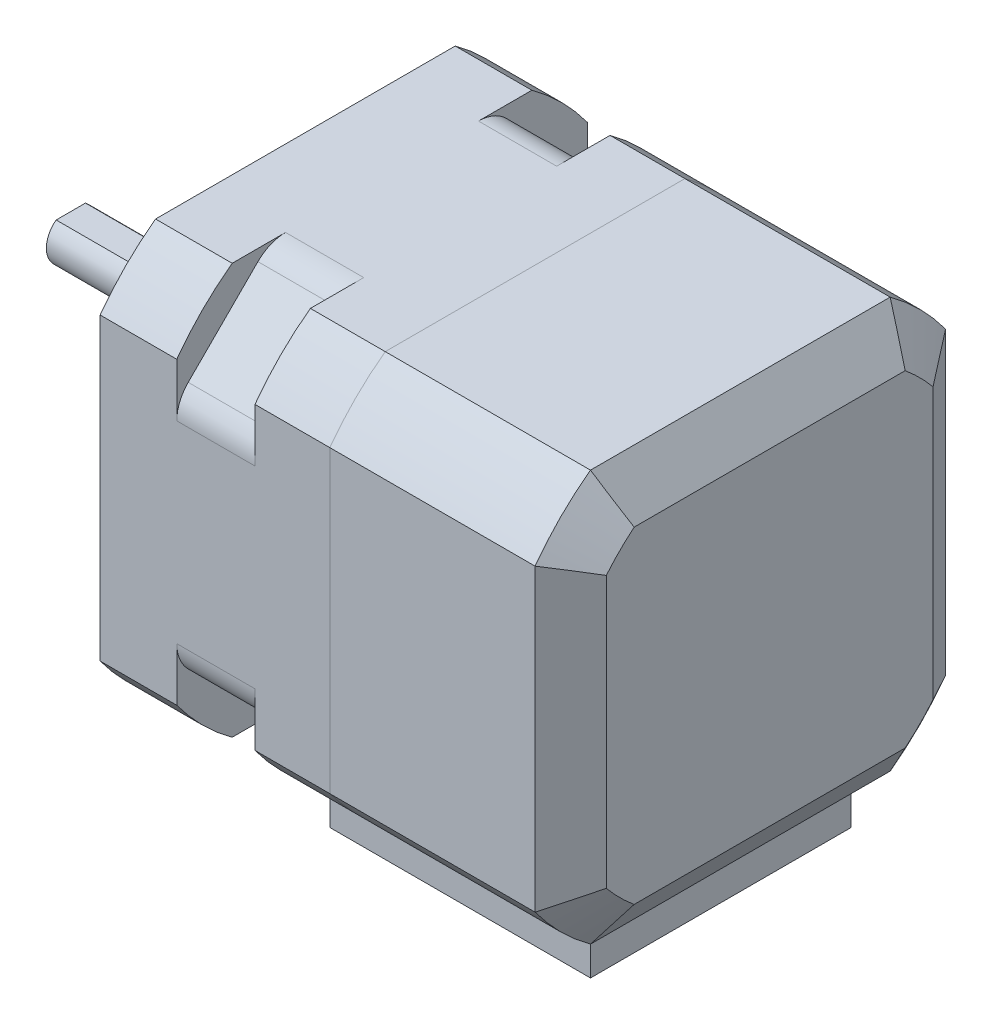
from build123d import *
from OCP.BRepFilletAPI import BRepFilletAPI_MakeChamfer

# Parameters (mm, degrees)
ESQUISSE1_W                  = 42
ESQUISSE1_H                  = 42
BOSS_EXTRU_1_DEPTH           = 47.5
ESQUISSE2_R                  = 11
BOSS_EXTRU_2_DEPTH           = 2
ESQUISSE3_R                  = 2.5
BOSS_EXTRU_3_DEPTH           = 24
TROU_TARAUD_M31_D            = 2.5
TROU_TARAUD_M31_DEPTH        = 4
TROU_TARAUD_M31_TIP          = 0.751075774
ESQUISSE6_OUTSIDE_W          = 62.59
ESQUISSE6_OUTSIDE_H          = 62.59
ESQUISSE6_OUTSIDE_R          = 26
ENL_V_MAT_EXTRU_1_DEPTH      = 57.020085684
ENL_V_MAT_EXTRU_2_DEPTH      = 57.020085684
ENL_V_MAT_EXTRU_2_DEPTH_BACK = 57.020085684
CHANFREIN1_SIZE              = 3
CHANFREIN1_SIZE2             = 4.28444402
ESQUISSE10_W                 = 26.659419434
ESQUISSE10_H                 = 26.659419434
BOSS_EXTRU_5_DEPTH           = 10
CHANFREIN2_SIZE              = 5
ESQUISSE11_OUTSIDE_W         = 63.576
ESQUISSE11_OUTSIDE_H         = 73.576
ENL_V_MAT_EXTRU_3_DEPTH      = 8
CONG_1_R                     = 4


with BuildPart() as part:
    # Esquisse1 → Boss.-Extru.1 (new body)
    with BuildSketch(Plane(origin=(0, 0, 0), x_dir=(0, 0, -1), z_dir=(1, 0, 0))):
        Rectangle(ESQUISSE1_W, ESQUISSE1_H)
    extrude(amount=BOSS_EXTRU_1_DEPTH)

    # Esquisse2 → Boss.-Extru.2 (add)
    with BuildSketch(Plane(origin=(0, 0, 0), x_dir=(0, 0, -1), z_dir=(1, 0, 0))):
        Circle(ESQUISSE2_R)
    extrude(amount=-BOSS_EXTRU_2_DEPTH)

    # Esquisse3 → Boss.-Extru.3 (add)
    with BuildSketch(Plane.ZY):
        with Locations(Location((0, 0, 0), (0, 0, 180))):
            Circle(ESQUISSE3_R)
    extrude(amount=BOSS_EXTRU_3_DEPTH)

    # Trou taraudé M31
    with Locations(Plane.ZY):
        with Locations((-15.5, 15.5), (15.5, 15.5), (-15.5, -15.5), (15.5, -15.5)):
            Hole(TROU_TARAUD_M31_D / 2, depth=TROU_TARAUD_M31_DEPTH)
            with Locations((0, 0, -(TROU_TARAUD_M31_DEPTH + TROU_TARAUD_M31_TIP / 2))):  # 118° drill point
                Cone(0, TROU_TARAUD_M31_D / 2, TROU_TARAUD_M31_TIP, mode=Mode.SUBTRACT)

    # Esquisse6 outside → Enlèv. mat.-Extru.1 (cut, through all)
    with BuildSketch(Plane(origin=(0, 0, 0), x_dir=(0, 0, -1), z_dir=(1, 0, 0))):
        Rectangle(ESQUISSE6_OUTSIDE_W, ESQUISSE6_OUTSIDE_H)
        Circle(ESQUISSE6_OUTSIDE_R, mode=Mode.SUBTRACT)
    extrude(amount=ENL_V_MAT_EXTRU_1_DEPTH, mode=Mode.SUBTRACT)

    # Esquisse7 → Enlèv. mat.-Extru.2 (cut, two sides: drawn at the far end of the back side and taken through both)
    with BuildSketch(Plane.XY.offset(-ENL_V_MAT_EXTRU_2_DEPTH_BACK)):
        Polygon((-184.216510411, 2), (-24, 2), (-9, 2), (-9, 2.5), (-9, 162.716510411), (-225.598714738, 398.856972015), (-400.815225149, 238.140461604), align=None)
    extrude(amount=ENL_V_MAT_EXTRU_2_DEPTH + ENL_V_MAT_EXTRU_2_DEPTH_BACK, mode=Mode.SUBTRACT)

    # Chanfrein1: one chamfer whose edges measure the first distance from different faces: ONE call of the kernel's chamfer builder (chamfer() names one face for all edges)
    chanfrein1_edges_1 = [part.edges().sort_by_distance(p)[0] for p in [
        (47.5, 0, 21),
    ]]
    chanfrein1_side_1 = [part.faces().sort_by_distance(p)[0] for p in [
        (23.75, 0, 21),
    ]]
    chanfrein1_edges_2 = [part.edges().sort_by_distance(p)[0] for p in [
        (47.5, -21, 0),
    ]]
    chanfrein1_side_2 = [part.faces().sort_by_distance(p)[0] for p in [
        (23.75, -21, 0),
    ]]
    chanfrein1_edges_3 = [part.edges().sort_by_distance(p)[0] for p in [
        (47.5, 0, -21),
    ]]
    chanfrein1_side_3 = [part.faces().sort_by_distance(p)[0] for p in [
        (23.75, 0, -21),
    ]]
    chanfrein1_edges_4 = [part.edges().sort_by_distance(p)[0] for p in [
        (47.5, 21, 0),
    ]]
    chanfrein1_side_4 = [part.faces().sort_by_distance(p)[0] for p in [
        (23.75, 21, 0),
    ]]
    chanfrein1_edges_5 = [part.edges().sort_by_distance(p)[0] for p in [
        (47.5, -18.384776311, 18.384776311),
    ]]
    chanfrein1_side_5 = [part.faces().sort_by_distance(p)[0] for p in [
        (23.75, -18.384776311, 18.384776311),
    ]]
    chanfrein1_edges_6 = [part.edges().sort_by_distance(p)[0] for p in [
        (47.5, 18.384776311, 18.384776311),
    ]]
    chanfrein1_side_6 = [part.faces().sort_by_distance(p)[0] for p in [
        (23.75, 18.384776311, 18.384776311),
    ]]
    chanfrein1_edges_7 = [part.edges().sort_by_distance(p)[0] for p in [
        (47.5, -18.384776311, -18.384776311),
    ]]
    chanfrein1_side_7 = [part.faces().sort_by_distance(p)[0] for p in [
        (23.75, -18.384776311, -18.384776311),
    ]]
    chanfrein1_edges_8 = [part.edges().sort_by_distance(p)[0] for p in [
        (47.5, 18.384776311, -18.384776311),
    ]]
    chanfrein1_side_8 = [part.faces().sort_by_distance(p)[0] for p in [
        (23.75, 18.384776311, -18.384776311),
    ]]
    chanfrein1 = BRepFilletAPI_MakeChamfer(part.part.solid().wrapped)
    for e in chanfrein1_edges_1:
        chanfrein1.Add(CHANFREIN1_SIZE, CHANFREIN1_SIZE2, e.wrapped, chanfrein1_side_1[0].wrapped)  # the first distance lies on this face
    for e in chanfrein1_edges_2:
        chanfrein1.Add(CHANFREIN1_SIZE, CHANFREIN1_SIZE2, e.wrapped, chanfrein1_side_2[0].wrapped)  # the first distance lies on this face
    for e in chanfrein1_edges_3:
        chanfrein1.Add(CHANFREIN1_SIZE, CHANFREIN1_SIZE2, e.wrapped, chanfrein1_side_3[0].wrapped)  # the first distance lies on this face
    for e in chanfrein1_edges_4:
        chanfrein1.Add(CHANFREIN1_SIZE, CHANFREIN1_SIZE2, e.wrapped, chanfrein1_side_4[0].wrapped)  # the first distance lies on this face
    for e in chanfrein1_edges_5:
        chanfrein1.Add(CHANFREIN1_SIZE, CHANFREIN1_SIZE2, e.wrapped, chanfrein1_side_5[0].wrapped)  # the first distance lies on this face
    for e in chanfrein1_edges_6:
        chanfrein1.Add(CHANFREIN1_SIZE, CHANFREIN1_SIZE2, e.wrapped, chanfrein1_side_6[0].wrapped)  # the first distance lies on this face
    for e in chanfrein1_edges_7:
        chanfrein1.Add(CHANFREIN1_SIZE, CHANFREIN1_SIZE2, e.wrapped, chanfrein1_side_7[0].wrapped)  # the first distance lies on this face
    for e in chanfrein1_edges_8:
        chanfrein1.Add(CHANFREIN1_SIZE, CHANFREIN1_SIZE2, e.wrapped, chanfrein1_side_8[0].wrapped)  # the first distance lies on this face
    add(Compound.cast(chanfrein1.Shape()), mode=Mode.REPLACE)

    # Esquisse10 → Boss.-Extru.5 (add)
    with BuildSketch(Plane.XZ.offset(21)):
        with Locations((29.170290283, 0)):
            Rectangle(ESQUISSE10_W, ESQUISSE10_H)
    extrude(amount=BOSS_EXTRU_5_DEPTH)

    # Chanfrein2
    chanfrein2_edges = [part.edges().sort_by_distance(p)[0] for p in [
        (42.5, -31, 0),
        (29.170290283, -31, 13.329709717),
        (29.170290283, -31, -13.329709717),
    ]]
    chamfer(chanfrein2_edges, length=CHANFREIN2_SIZE)

    # Esquisse11 outside → Enlèv. mat.-Extru.3 (cut)
    with BuildSketch(Plane.ZY.offset(-15.840580566)):
        with Locations((0, -5)):
            Rectangle(ESQUISSE11_OUTSIDE_W, ESQUISSE11_OUTSIDE_H)
        Polygon((0, 32.526911935), (-32.526911935, 0), (0, -32.526911935), (32.526911935, 0), align=None, mode=Mode.SUBTRACT)
    extrude(amount=ENL_V_MAT_EXTRU_3_DEPTH, mode=Mode.SUBTRACT)

    # Congé1
    cong_1_edges = [part.edges().sort_by_distance(p)[0] for p in [
        (11.840580566, 21, -11.526911935),
        (11.840580566, 21, 11.526911935),
        (11.840580566, 11.526911935, 21),
        (11.840580566, 11.526911935, -21),
        (11.840580566, -21, -11.526911935),
        (11.840580566, -11.526911935, -21),
        (11.840580566, -21, 11.526911935),
        (11.840580566, -11.526911935, 21),
    ]]
    fillet(cong_1_edges, radius=CONG_1_R)


solid = part.part
